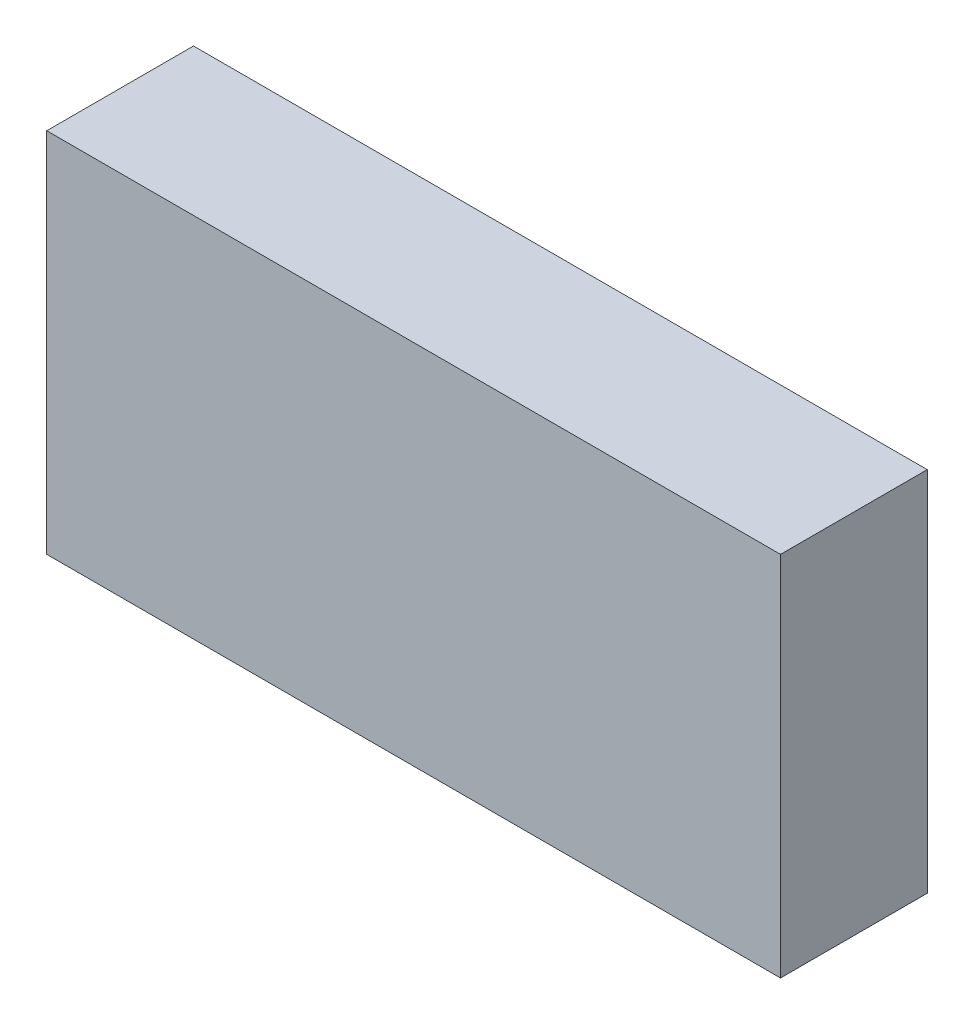
from build123d import *

# Parameters (mm, degrees)
ESBO_O1_W                = 60
ESBO_O1_H                = 30
RESSALTO_EXTRUS_O1_DEPTH = 12


with BuildPart() as part:
    # Esboço1 → Ressalto-extrusão1 (new body)
    with BuildSketch(Plane.XY):
        Rectangle(ESBO_O1_W, ESBO_O1_H)
    extrude(amount=-RESSALTO_EXTRUS_O1_DEPTH)


solid = part.part
